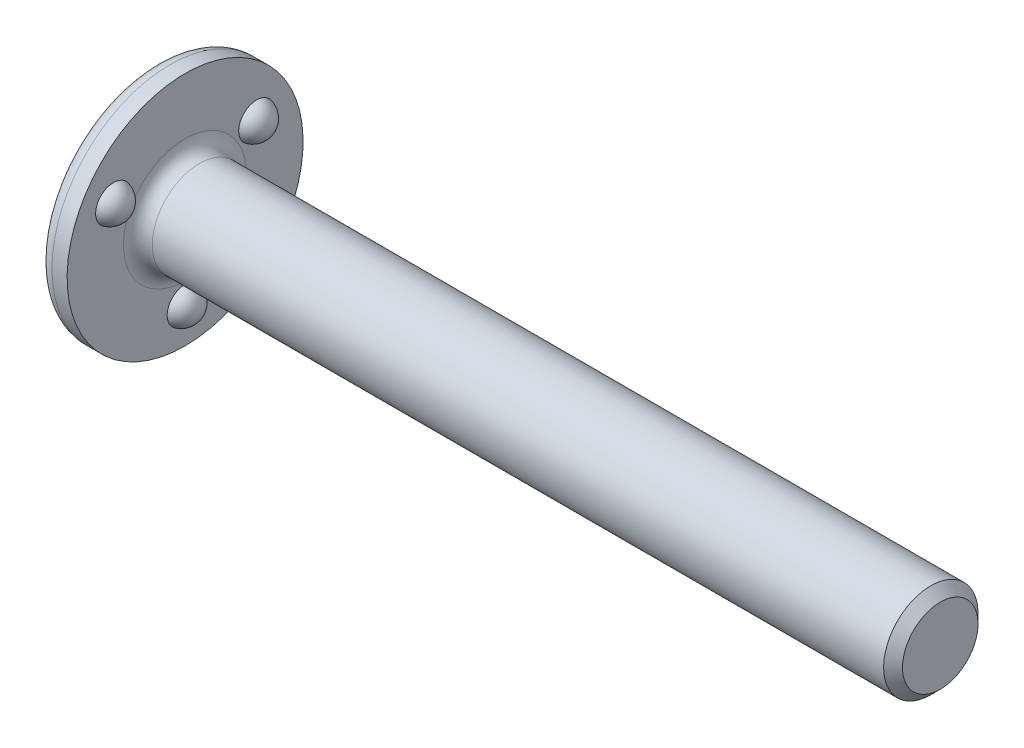
from build123d import *

# Parameters (mm, degrees)
CHAMFER1_SIZE     = 0.635
CIRPATTERN1_COUNT = 3
FILLET1_R         = 0.9652


with BuildPart() as part:
    # Sketch1 → Revolve1 (revolve)
    with BuildSketch(Plane.XY, mode=Mode.PRIVATE) as revolve1_sk:
        Polygon((0, 0), (0, 7.9375), (1.984375, 7.9375), (1.984375, 3.175), (52.784375, 3.175), (52.784375, 0), align=None)
    revolve(revolve1_sk.sketch.rotate(Axis((0, 0, 0), (1, 0, 0)), 180), axis=Axis((0, 0, 0), (1, 0, 0)))

    # Chamfer1
    chamfer1_edges = [part.edges().sort_by_distance(p)[0] for p in [
        (52.784375, 3.175, 0),
    ]]
    chamfer(chamfer1_edges, length=CHAMFER1_SIZE)

    # Sketch2 → Revolve2 (revolve)
    with BuildSketch(Plane.XY, mode=Mode.PRIVATE) as revolve2_sk:
        with BuildLine():
            Line((1.984375, -5.55625), (2.949575, -5.55625))
            ThreePointArc((2.949575, -5.55625), (2.678583674, -4.783713061), (1.984375, -4.34975))
            Line((1.984375, -4.34975), (1.984375, -5.55625))
        make_face()
    revolve2 = revolve(revolve2_sk.sketch.rotate(Axis((1.984375, -5.55625, 0), (-1, 0, 0)), 180), axis=Axis((1.984375, -5.55625, 0), (-1, 0, 0)))

    # CirPattern1: Revolve2 ×3 about axis
    cirpattern1_axis = Axis((0, 0, 0), (1, 0, 0))
    for i in range(1, CIRPATTERN1_COUNT):
        add(revolve2.rotate(cirpattern1_axis, i * 360 / CIRPATTERN1_COUNT))

    # Fillet1
    fillet1_edges = [part.edges().sort_by_distance(p)[0] for p in [
        (1.984375, 3.175, 0),
        (0, 7.9375, 0),
    ]]
    fillet(fillet1_edges, radius=FILLET1_R)


solid = part.part
